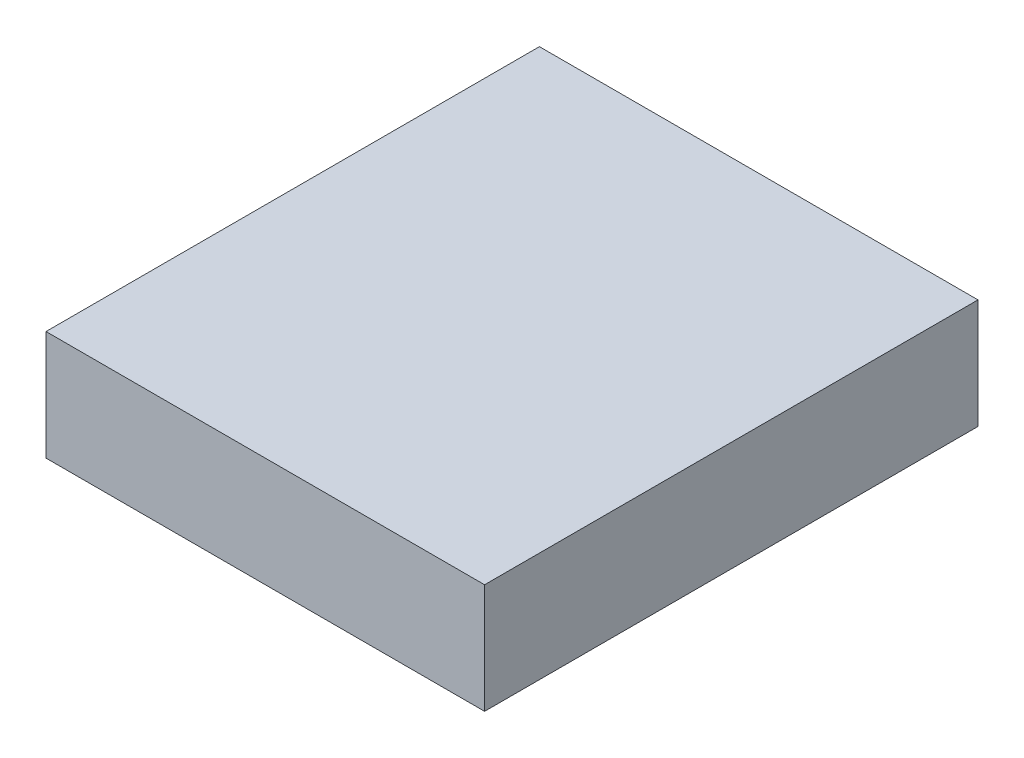
from build123d import *

# Parameters (mm, degrees)
SKETCH1_W           = 2
SKETCH1_H           = 2.25
BOSS_EXTRUDE1_DEPTH = 0.5


with BuildPart() as part:
    # Sketch1 → Boss-Extrude1 (new body)
    with BuildSketch(Plane(origin=(0, 0, 0), x_dir=(1, 0, 0), z_dir=(0, 1, 0))):
        Rectangle(SKETCH1_W, SKETCH1_H)
    extrude(amount=BOSS_EXTRUDE1_DEPTH)


solid = part.part
